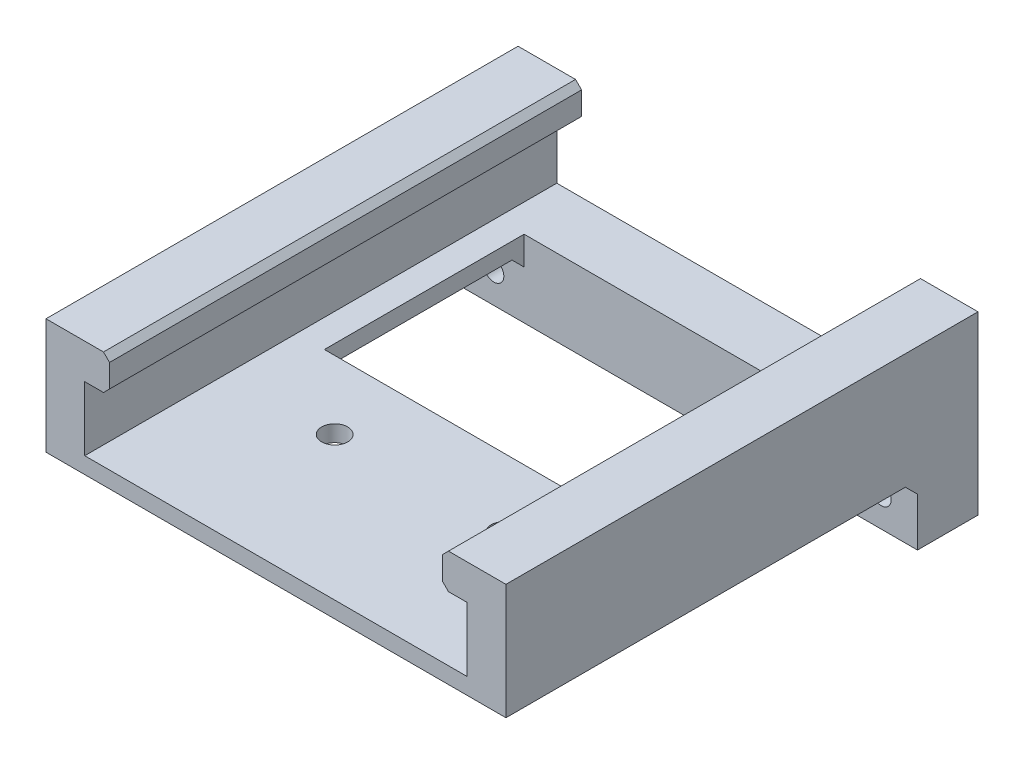
from build123d import *

# Parameters (mm, degrees)
EXTRUDE_1_DEPTH      = 39
HOLE_WIZARD_M4_1_D   = 4.3
CHAMFER_1_SIZE       = 1
SKETCH_8_W           = 76
SKETCH_8_H           = 10
EXTRUDE_2_DEPTH      = 10
CUT_EXTRUDE_2_REACH  = 59.705
SKETCH_9_W           = 54
SKETCH_9_H           = 33
CHAMFER_2_SIZE       = 2
HOLE_WIZARD_M4_1_2_D = 3.3


with BuildPart() as part:
    # 草图1 → 凸台-拉伸1 (new, symmetric)
    with BuildSketch(Plane.XY):
        Polygon((-27.5, 19.1), (-38, 19.1), (-38, 0), (38, 0), (38, 19.1), (27.5, 19.1), (27.5, 13.3), (31.6, 13.3), (31.6, 2.7), (-31.6, 2.7), (-31.6, 13.3), (-27.5, 13.3), align=None)
    extrude(amount=EXTRUDE_1_DEPTH, both=True)

    # Hole Wizard M4 _1 (through all)
    with Locations(Plane(origin=(0, 0, 0), x_dir=(-1, 0, 0), z_dir=(0, -1, 0))):
        with Locations((-14, -15.3), (14, -15.3)):
            Hole(HOLE_WIZARD_M4_1_D / 2)

    # 倒角1
    chamfer_1_edges = [part.edges().sort_by_distance(p)[0] for p in [
        (-27.5, 13.3, 0),
        (27.5, 13.3, 0),
        (27.5, 19.1, 0),
        (-27.5, 19.1, 0),
    ]]
    chamfer(chamfer_1_edges, length=CHAMFER_1_SIZE)

    # 草图8 → 凸台-拉伸2 (add)
    with BuildSketch(Plane.XZ):
        with Locations((0, -34)):
            Rectangle(SKETCH_8_W, SKETCH_8_H)
    extrude(amount=EXTRUDE_2_DEPTH)

    # 草图9 → 切除-拉伸2 (cut, up to next)
    with BuildSketch(Plane.XZ, mode=Mode.PRIVATE) as cut_extrude_2_sk1:
        with Locations((0, -12.5)):
            Rectangle(SKETCH_9_W, SKETCH_9_H)
    cut_extrude_2_tool1 = extrude(cut_extrude_2_sk1.sketch, amount=-CUT_EXTRUDE_2_REACH, mode=Mode.PRIVATE) & part.part
    add(cut_extrude_2_tool1.solids().sort_by_distance((0, 0, -12.5))[0], mode=Mode.SUBTRACT)

    # 倒角2
    chamfer_2_edges = [part.edges().sort_by_distance(p)[0] for p in [
        (32.5, 0, -29),
        (-32.5, 0, -29),
    ]]
    chamfer(chamfer_2_edges, length=CHAMFER_2_SIZE)

    # Hole Wizard M4 _1 2 (through all)
    with Locations(Plane(origin=(0, 0, -39), x_dir=(-1, 0, 0), z_dir=(0, 0, -1))):
        with Locations((32, -5), (-32, -5)):
            Hole(HOLE_WIZARD_M4_1_2_D / 2)


solid = part.part
